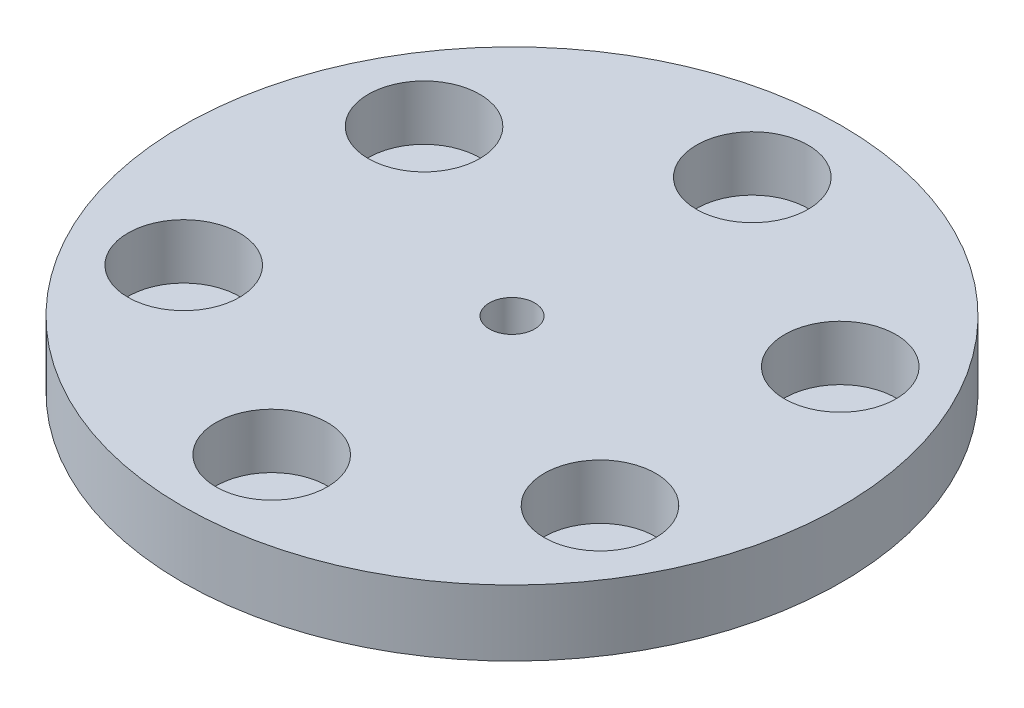
from build123d import *

# Parameters (mm, degrees)
ESBO_O1_R                = 60
ESBO_O1_R_2              = 4.125
RESSALTO_EXTRUS_O1_DEPTH = 12
ESBO_O2_R                = 10.15
CORTE_EXTRUS_O1_DEPTH    = 10


with BuildPart() as part:
    # Esboço1 → Ressalto-extrusão1 (new body)
    with BuildSketch(Plane(origin=(0, 0, 0), x_dir=(1, 0, 0), z_dir=(0, 1, 0))):
        with Locations(Location((0, 0, 0), (0, 0, 270))):
            Circle(ESBO_O1_R)
        with Locations(Location((0, 0, 0), (0, 0, 270))):
            Circle(ESBO_O1_R_2, mode=Mode.SUBTRACT)
    extrude(amount=RESSALTO_EXTRUS_O1_DEPTH)

    # Esboço2 → Corte-extrusão1 (cut)
    with BuildSketch(Plane(origin=(0, 12, 0), x_dir=(1, 0, 0), z_dir=(0, 1, 0))):
        with Locations(Location((0, 43.75, 0), (0, 0, 270))):
            Circle(ESBO_O2_R)
        with Locations(Location((37.888611416, 21.875, 0), (0, 0, 270))):
            Circle(ESBO_O2_R)
        with Locations(Location((37.888611416, -21.875, 0), (0, 0, 270))):
            Circle(ESBO_O2_R)
        with Locations(Location((0, -43.75, 0), (0, 0, 270))):
            Circle(ESBO_O2_R)
        with Locations(Location((-37.888611416, -21.875, 0), (0, 0, 270))):
            Circle(ESBO_O2_R)
        with Locations(Location((-37.888611416, 21.875, 0), (0, 0, 270))):
            Circle(ESBO_O2_R)
    extrude(amount=-CORTE_EXTRUS_O1_DEPTH, mode=Mode.SUBTRACT)


solid = part.part
